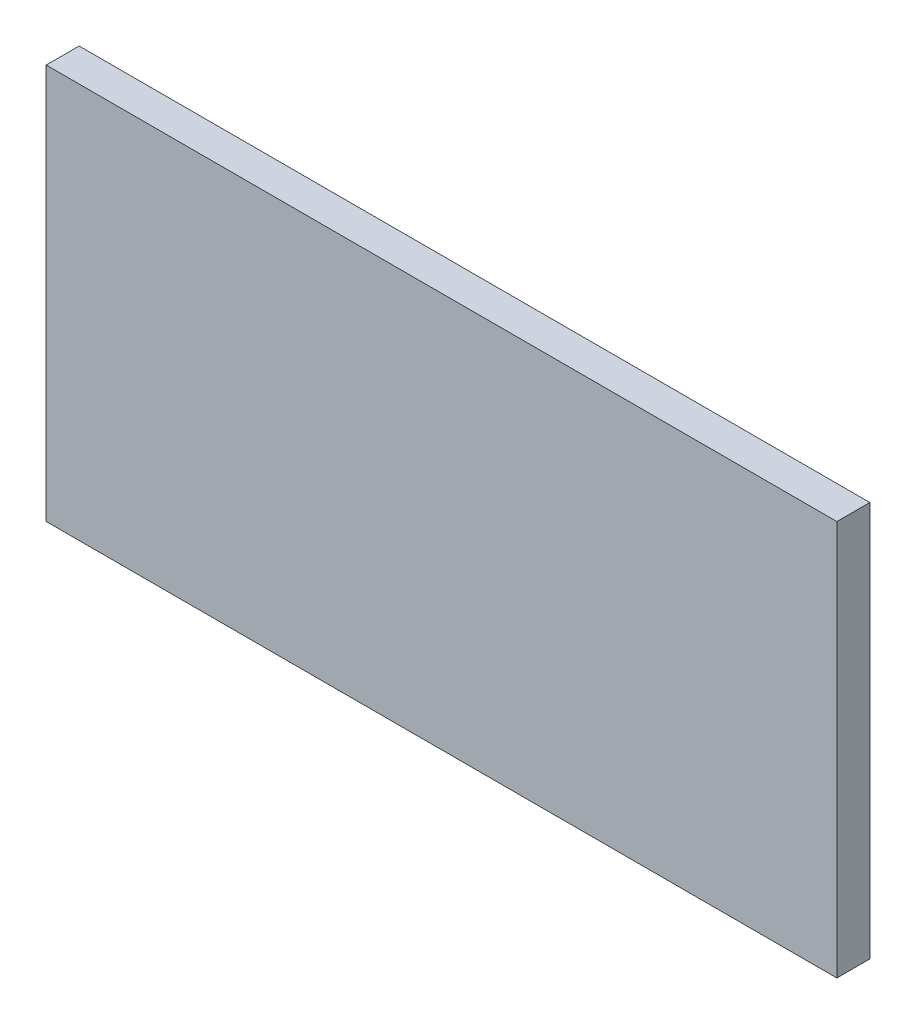
from build123d import *

# Parameters (mm, degrees)
SKETCH1_W           = 120
SKETCH1_H           = 60
BOSS_EXTRUDE1_DEPTH = 5


with BuildPart() as part:
    # Sketch1 → Boss-Extrude1 (new body)
    with BuildSketch(Plane.XY):
        with Locations((60, -30)):
            Rectangle(SKETCH1_W, SKETCH1_H)
    extrude(amount=BOSS_EXTRUDE1_DEPTH)


solid = part.part
